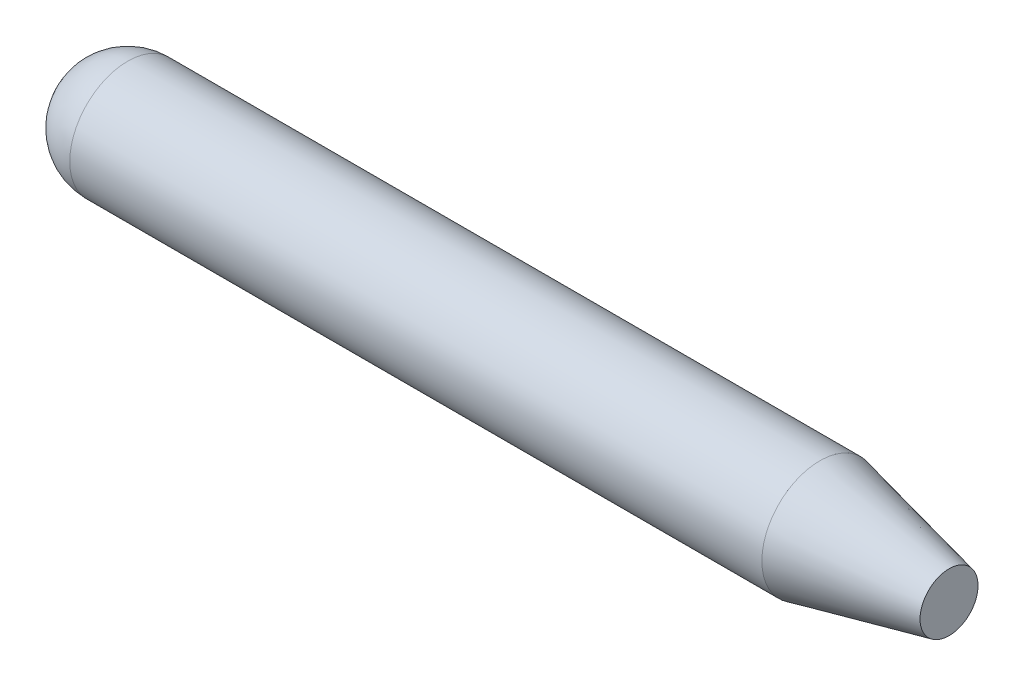
from build123d import *


with BuildPart() as part:
    # Sketch1 → Revolve1 (revolve)
    with BuildSketch(Plane.XY, mode=Mode.PRIVATE) as revolve1_sk:
        with BuildLine():
            Line((68.58, 68.58), (887.407793025, 68.58))
            Line((887.407793025, 68.58), (1040.275199788, 34.325403524))
            Line((1040.275199788, 34.325403524), (1040.275199788, 0))
            Line((1040.275199788, 0), (0, 0))
            ThreePointArc((0, 0), (20.086616946, 48.493383054), (68.58, 68.58))
        make_face()
    revolve(revolve1_sk.sketch.rotate(Axis((0, 0, 0), (1, 0, 0)), 90), axis=Axis((0, 0, 0), (1, 0, 0)))


with BuildPart() as part_1:
    # Body-Move/Copy1: moved
    add(part.part.moved(Location((-518.16, 0, 0))))


solid = part_1.part
